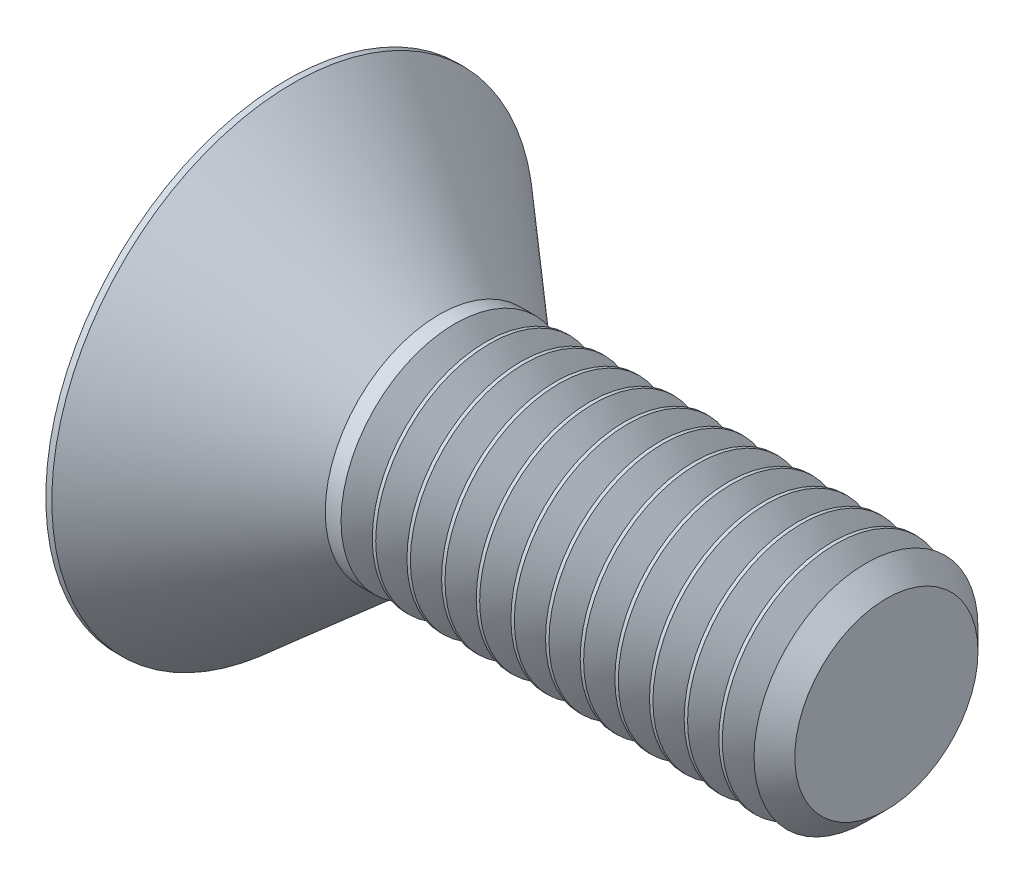
from build123d import *

# Parameters (mm, degrees)
CUT_EXTRUDE1_DEPTH = 2.2098


with BuildPart() as part:
    # Sketch1 → Revolve1 (revolve)
    with BuildSketch(Plane.XY, mode=Mode.PRIVATE) as revolve1_sk:
        Polygon((0, 5.10667), (0, 0), (12.7, 0), (12.7, 1.94056), (12.268263383, 2.372296616), (11.96595815, 1.94056), (11.635152101, 2.413), (11.56269695, 2.413), (11.2318909, 1.94056), (10.901084851, 2.413), (10.8286297, 2.413), (10.49782365, 1.94056), (10.167017601, 2.413), (10.09456245, 2.413), (9.7637564, 1.94056), (9.432950351, 2.413), (9.3604952, 2.413), (9.02968915, 1.94056), (8.698883101, 2.413), (8.62642795, 2.413), (8.2956219, 1.94056), (7.964815851, 2.413), (7.8923607, 2.413), (7.561554651, 1.94056), (7.230748601, 2.413), (7.15829345, 2.413), (6.827487401, 1.94056), (6.496681351, 2.413), (6.4242262, 2.413), (6.093420151, 1.94056), (5.762614101, 2.413), (5.69015895, 2.413), (5.359352901, 1.94056), (5.028546851, 2.413), (4.9560917, 2.413), (4.625285651, 1.94056), (4.294479601, 2.413), (4.22202445, 2.413), (3.891218401, 1.94056), (3.560412352, 2.413), (3.225712867, 2.413), (0.127, 5.10667), align=None)
    revolve(revolve1_sk.sketch.rotate(Axis((0, 0, 0), (1, 0, 0)), 270), axis=Axis((0, 0, 0), (1, 0, 0)))

    # Sketch2 → Cut-Extrude1 (cut)
    with BuildSketch(Plane.ZY):
        Polygon((0, 1.833087105), (-1.5875, 0.916543552), (-1.5875, -0.916543552), (0, -1.833087105), (1.5875, -0.916543552), (1.5875, 0.916543552), align=None)
    extrude(amount=-CUT_EXTRUDE1_DEPTH, mode=Mode.SUBTRACT)

    # Sketch3 → Cut-Revolve1 (revolve, cut)
    with BuildSketch(Plane.XY, mode=Mode.PRIVATE) as cut_revolve1_sk:
        Polygon((2.2098, 1.5875), (2.2098, 0), (3.126343553, 0), align=None)
    revolve(cut_revolve1_sk.sketch.rotate(Axis((2.209775, 0, 0), (1, 0, 0)), 90), axis=Axis((2.209775, 0, 0), (1, 0, 0)), mode=Mode.SUBTRACT)


solid = part.part
